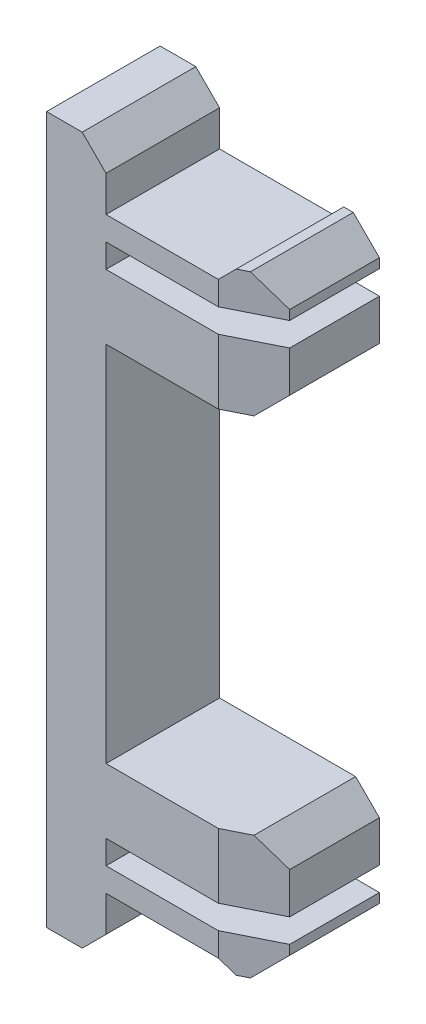
from build123d import *

# Parameters (mm, degrees)
BOSS_EXTRUDE1_DEPTH             = 3.032500031
BOSS_EXTRUDE2_REACH             = 21.994
BOSS_EXTRUDE2_DIRECTION_2_REACH = 21.994
CUT_EXTRUDE1_DEPTH              = 30.326387225


with BuildPart() as part:
    # Sketch1 → Boss-Extrude1 (new, symmetric)
    with BuildSketch(Plane.XY):
        Polygon((-3.9525, -18.875), (-5.8575, -18.875), (-5.8575, 18.875), (-3.9525, 18.875), (-2.6825, 17.605), (-2.6825, -17.605), align=None)
    extrude(amount=BOSS_EXTRUDE1_DEPTH, both=True)

    # Boss-Extrude2: up to this face of the body (flat: up to its plane)
    boss_extrude2_end = Plane(part.part.faces().sort_by_distance((-4.285879831, 0, 3.032500031))[0])
    # Sketch1<3> → Boss-Extrude2 (add, up to the picked face)
    with BuildSketch(Plane.XY, mode=Mode.PRIVATE) as boss_extrude2_sk1:
        Polygon((-2.6825, 13.16), (-2.6825, 9.7), (4.5875, 9.7), (5.8575, 10.97), (5.8575, 13.16), align=None)
    boss_extrude2_tool1 = split(extrude(boss_extrude2_sk1.sketch, amount=BOSS_EXTRUDE2_REACH, mode=Mode.PRIVATE), bisect_by=boss_extrude2_end, keep=Keep.BOTH, mode=Mode.PRIVATE)
    # Sketch1<3> → Boss-Extrude2 (add, up to the picked face)
    with BuildSketch(Plane.XY, mode=Mode.PRIVATE) as boss_extrude2_sk2:
        Polygon((-2.6825, 15.7), (-2.6825, 14.43), (5.8575, 14.43), (5.8575, 14.938), (4.4605, 16.335), (3.9525, 16.335), (3.3175, 15.7), align=None)
    boss_extrude2_tool2 = split(extrude(boss_extrude2_sk2.sketch, amount=BOSS_EXTRUDE2_REACH, mode=Mode.PRIVATE), bisect_by=boss_extrude2_end, keep=Keep.BOTH, mode=Mode.PRIVATE)
    add(boss_extrude2_tool1.solids().sort_by(Axis((1.479569, 11.466663, 0), (0, 0, 1)))[0])
    add(boss_extrude2_tool2.solids().sort_by(Axis((1.652648, 15.112693, 0), (0, 0, 1)))[0])

    # Boss-Extrude2 direction 2: up to this face of the body (flat: up to its plane)
    boss_extrude2_direction_2_end = Plane(part.part.faces().sort_by_distance((-4.285879831, 0, -3.032500031))[0])
    # Sketch1<3> → Boss-Extrude2 direction 2 (add, up to the picked face)
    with BuildSketch(Plane.XY, mode=Mode.PRIVATE) as boss_extrude2_direction_2_sk1:
        Polygon((-2.6825, 13.16), (-2.6825, 9.7), (4.5875, 9.7), (5.8575, 10.97), (5.8575, 13.16), align=None)
    boss_extrude2_direction_2_tool1 = split(extrude(boss_extrude2_direction_2_sk1.sketch, amount=-BOSS_EXTRUDE2_DIRECTION_2_REACH, mode=Mode.PRIVATE), bisect_by=boss_extrude2_direction_2_end, keep=Keep.BOTH, mode=Mode.PRIVATE)
    # Sketch1<3> → Boss-Extrude2 direction 2 (add, up to the picked face)
    with BuildSketch(Plane.XY, mode=Mode.PRIVATE) as boss_extrude2_direction_2_sk2:
        Polygon((-2.6825, 15.7), (-2.6825, 14.43), (5.8575, 14.43), (5.8575, 14.938), (4.4605, 16.335), (3.9525, 16.335), (3.3175, 15.7), align=None)
    boss_extrude2_direction_2_tool2 = split(extrude(boss_extrude2_direction_2_sk2.sketch, amount=-BOSS_EXTRUDE2_DIRECTION_2_REACH, mode=Mode.PRIVATE), bisect_by=boss_extrude2_direction_2_end, keep=Keep.BOTH, mode=Mode.PRIVATE)
    add(boss_extrude2_direction_2_tool1.solids().sort_by(Axis((1.479569, 11.466663, 0), (0, 0, -1)))[0])
    add(boss_extrude2_direction_2_tool2.solids().sort_by(Axis((1.652648, 15.112693, 0), (0, 0, -1)))[0])

    # Sketch2 → Cut-Extrude1 (cut, through all)
    with BuildSketch(Plane.XZ.offset(-9.7)):
        Polygon((3.3175, 3.032500031), (5.8575, 1.762500031), (5.8575, 3.032500031), align=None)
    extrude(amount=-CUT_EXTRUDE1_DEPTH, mode=Mode.SUBTRACT)

    # Mirror2: part across plane


with BuildPart() as part_1:
    add(part.part)
    add(part.part.mirror(Plane.ZX))


solid = part_1.part
